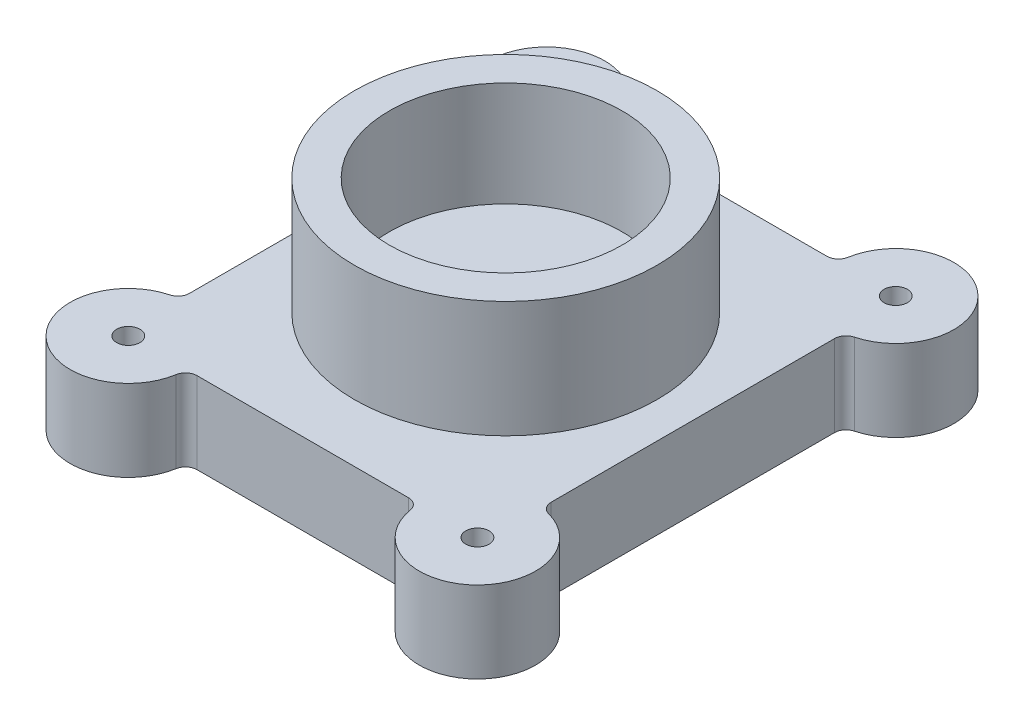
from build123d import *

# Parameters (mm, degrees)
BOSS_EXTRUDE1_DEPTH = 70
SKETCH2_R           = 130
BOSS_EXTRUDE2_DEPTH = 100
SKETCH5_R           = 10
CUT_EXTRUDE1_DEPTH  = 324.960703978
SKETCH6_R           = 100
CUT_EXTRUDE2_DEPTH  = 90


with BuildPart() as part:
    # Sketch1 → Boss-Extrude1 (new body)
    with BuildSketch(Plane(origin=(0, 0, 0), x_dir=(1, 0, 0), z_dir=(0, 1, 0))):
        with BuildLine():
            Line((-85.450778727, 179.708800959), (96.227625611, 179.708800959))
            ThreePointArc((96.227625611, 179.708800959), (102.682597854, 182.071174801), (106.087758582, 188.042134293))
            ThreePointArc((106.087758582, 188.042134293), (189.081994137, 216.651233118), (168.212109643, 131.381240787))
            ThreePointArc((168.212109643, 131.381240787), (162.850707457, 127.812966963), (160.776846883, 121.715728753))
            Line((160.776846883, 121.715728753), (160.776846883, -121.715728753))
            ThreePointArc((160.776846883, -121.715728753), (162.850707457, -127.812966963), (168.212109643, -131.381240787))
            ThreePointArc((168.212109643, -131.381240787), (189.081994137, -216.651233118), (106.087758582, -188.042134293))
            ThreePointArc((106.087758582, -188.042134293), (102.682597854, -182.071174801), (96.227625611, -179.708800959))
            Line((96.227625611, -179.708800959), (-85.450778727, -179.708800959))
            ThreePointArc((-85.450778727, -179.708800959), (-91.905750971, -182.071174801), (-95.310911699, -188.042134293))
            ThreePointArc((-95.310911699, -188.042134293), (-178.305147254, -216.651233118), (-157.43526276, -131.381240787))
            ThreePointArc((-157.43526276, -131.381240787), (-152.073860574, -127.812966963), (-150, -121.715728753))
            Line((-150, -121.715728753), (-150, 121.715728753))
            ThreePointArc((-150, 121.715728753), (-152.073860574, 127.812966963), (-157.43526276, 131.381240787))
            ThreePointArc((-157.43526276, 131.381240787), (-178.305147254, 216.651233118), (-95.310911699, 188.042134293))
            ThreePointArc((-95.310911699, 188.042134293), (-91.905750971, 182.071174801), (-85.450778727, 179.708800959))
        make_face()
    extrude(amount=BOSS_EXTRUDE1_DEPTH)

    # Sketch2 → Boss-Extrude2 (add)
    with BuildSketch(Plane(origin=(0, 70, 0), x_dir=(1, 0, 0), z_dir=(0, 1, 0))):
        with Locations(Location((0, 0, 0), (0, 0, 90))):
            Circle(SKETCH2_R)
    extrude(amount=BOSS_EXTRUDE2_DEPTH)

    # Sketch5 → Cut-Extrude1 (cut, through all)
    with BuildSketch(Plane(origin=(0, 70, 0), x_dir=(1, 0, 0), z_dir=(0, 1, 0))):
        with Locations(Location((-144.611576558, -179.708800959, 0), (0, 0, 270))):
            Circle(SKETCH5_R)
        with Locations(Location((-144.611576558, 179.708800959, 0), (0, 0, 270))):
            Circle(SKETCH5_R)
        with Locations(Location((155.388423442, -179.708800959, 0), (0, 0, 270))):
            Circle(SKETCH5_R)
        with Locations(Location((155.388423442, 179.708800959, 0), (0, 0, 270))):
            Circle(SKETCH5_R)
    extrude(amount=-CUT_EXTRUDE1_DEPTH, mode=Mode.SUBTRACT)

    # Sketch6 → Cut-Extrude2 (cut)
    with BuildSketch(Plane(origin=(0, 170, 0), x_dir=(1, 0, 0), z_dir=(0, 1, 0))):
        with Locations(Location((0, 0, 0), (0, 0, 270))):
            Circle(SKETCH6_R)
    extrude(amount=-CUT_EXTRUDE2_DEPTH, mode=Mode.SUBTRACT)


solid = part.part
